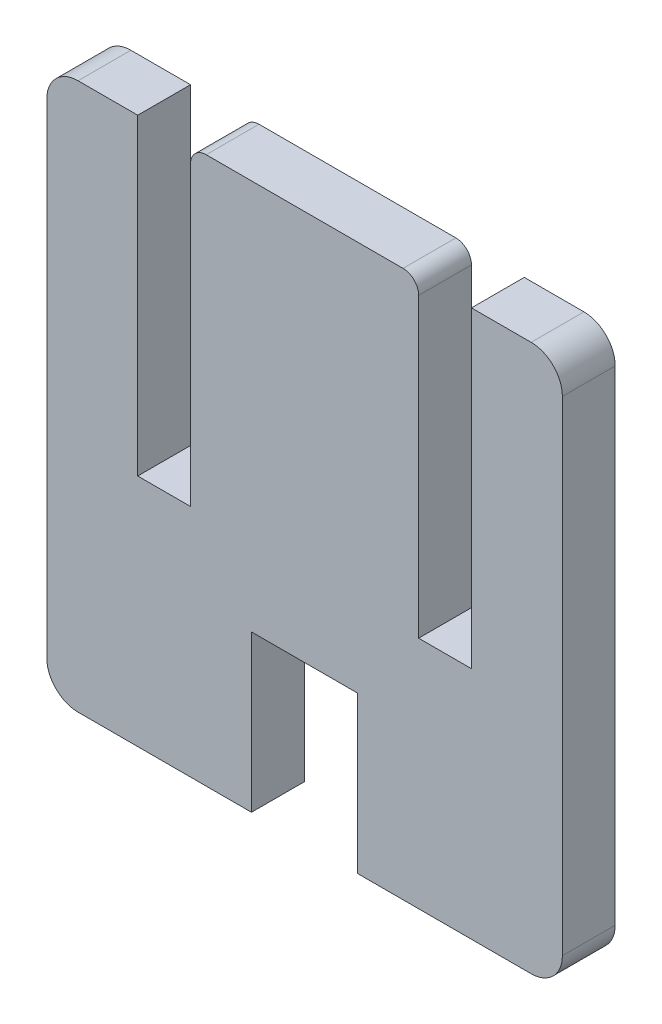
from build123d import *

# Parameters (mm, degrees)
SKETCH1_W           = 41.91
SKETCH1_H           = 44.45
BOSS_EXTRUDE1_DEPTH = 4.2926
FILLET1_R           = 2.54
SKETCH2_W           = 4.2926
SKETCH2_H           = 25.4
SKETCH2_W_2         = 8.636
SKETCH2_H_2         = 12.7
CUT_EXTRUDE2_DEPTH  = 4.2926
FILLET3_R           = 1.27


with BuildPart() as part:
    # Sketch1 → Boss-Extrude1 (new body)
    with BuildSketch(Plane.XY):
        Rectangle(SKETCH1_W, SKETCH1_H)
    extrude(amount=BOSS_EXTRUDE1_DEPTH)

    # Fillet1
    fillet1_edges = [part.edges().sort_by_distance(p)[0] for p in [
        (20.955, -22.225, 2.1463),
        (-20.955, -22.225, 2.1463),
        (-20.955, 22.225, 2.1463),
        (20.955, 22.225, 2.1463),
    ]]
    fillet(fillet1_edges, radius=FILLET1_R)

    # Sketch2 → Cut-Extrude2 (cut)
    with BuildSketch(Plane.XY.offset(4.2926)):
        with Locations((-11.4173, 9.525)):
            Rectangle(SKETCH2_W, SKETCH2_H)
        with Locations((11.4173, 9.525)):
            Rectangle(SKETCH2_W, SKETCH2_H)
        with Locations((0, -15.875)):
            Rectangle(SKETCH2_W_2, SKETCH2_H_2)
    extrude(amount=-CUT_EXTRUDE2_DEPTH, mode=Mode.SUBTRACT)

    # Fillet3
    fillet3_edges = [part.edges().sort_by_distance(p)[0] for p in [
        (-9.271, 22.225, 2.1463),
        (9.271, 22.225, 2.1463),
    ]]
    fillet(fillet3_edges, radius=FILLET3_R)


solid = part.part
